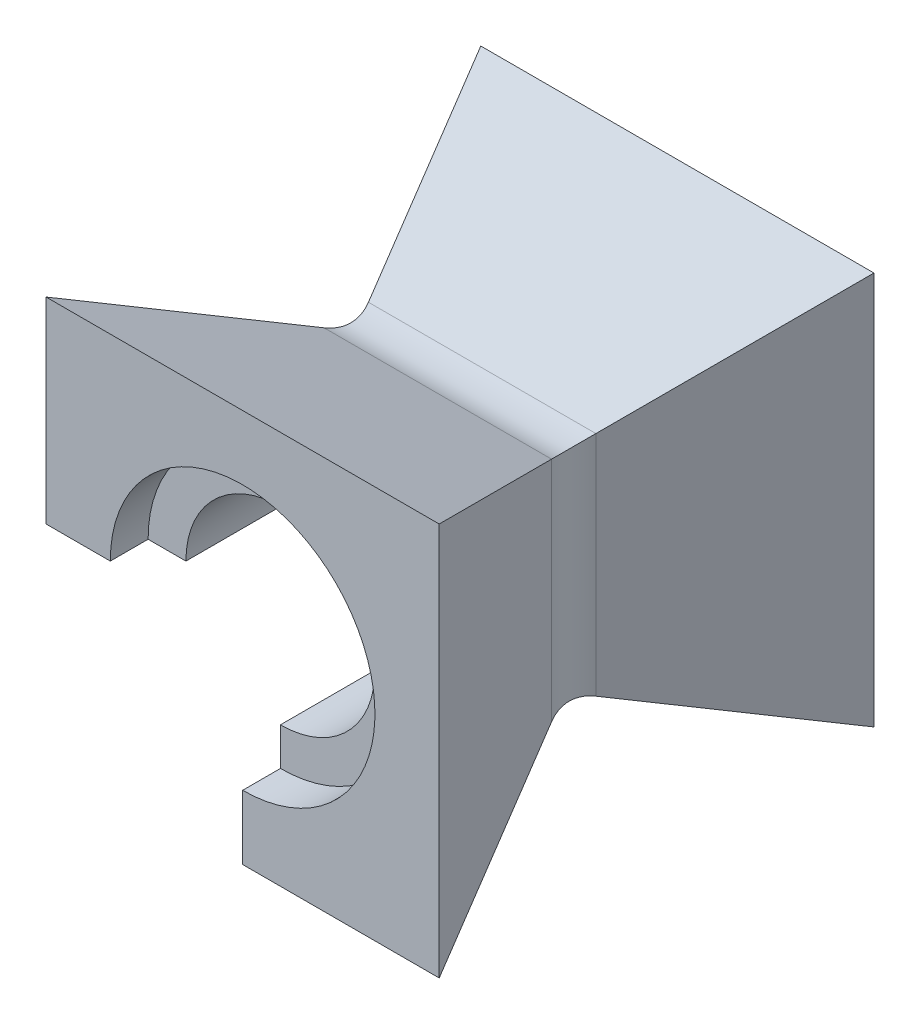
from build123d import *

# Parameters (mm, degrees)
SKETCH4_W               = 104
SKETCH4_H               = 104
BOSS_EXTRUDE2_DEPTH     = 57.5
BOSS_EXTRUDE2_TAPER     = 23
SKETCH6_R               = 25
CUT_EXTRUDE1_DEPTH      = 179.5
CUT_EXTRUDE_THIN1_START = 10
CUT_EXTRUDE_THIN1_DEPTH = 10
CUT_EXTRUDE3_DEPTH      = 124
SKETCH10_R              = 35
CUT_EXTRUDE4_DEPTH      = 10
FILLET9_R               = 15
FILLET10_R              = 15


with BuildPart() as part:
    # Sketch4 → Boss-Extrude2 (new body)
    with BuildSketch(Plane.XY):
        with Locations((52, 52)):
            Rectangle(SKETCH4_W, SKETCH4_H)
    boss_extrude2 = extrude(amount=BOSS_EXTRUDE2_DEPTH, taper=BOSS_EXTRUDE2_TAPER)

    # Mirror2: Boss-Extrude2 across plane
    add(boss_extrude2.mirror(Plane(origin=(0, 0, 57.5), x_dir=(1, 0, 0), z_dir=(0, 0, -1))))

    # Sketch6 → Cut-Extrude1 (cut)
    with BuildSketch(Plane.XY.offset(115)):
        with Locations((52, 52)):
            Circle(SKETCH6_R)
    extrude(amount=-CUT_EXTRUDE1_DEPTH, mode=Mode.SUBTRACT)

    # Sketch8 → Cut-Extrude-Thin1 (cut)
    with BuildSketch(Plane.XY.offset(CUT_EXTRUDE_THIN1_START)):
        with BuildLine():
            ThreePointArc((52, 17), (76.748737342, 76.748737342), (17, 52))
            Line((17, 52), (7, 52))
            ThreePointArc((7, 52), (83.819805153, 83.819805153), (52, 7))
            Line((52, 7), (52, 17))
        make_face()
        with BuildLine():
            ThreePointArc((52, 27), (69.67766953, 69.67766953), (27, 52))
            Line((27, 52), (17, 52))
            ThreePointArc((17, 52), (76.748737342, 76.748737342), (52, 17))
            Line((52, 17), (52, 27))
        make_face()
    extrude(amount=-CUT_EXTRUDE_THIN1_DEPTH, mode=Mode.SUBTRACT)

    # Sketch9 → Cut-Extrude3 (cut)
    with BuildSketch(Plane(origin=(0, 0, 0), x_dir=(-1, 0, 0), z_dir=(0, 0, -1))):
        Polygon((-27, 52), (0, 52), (0, 0), (-52, 0), (-52, 27), (-52, 52), align=None)
    extrude(amount=-CUT_EXTRUDE3_DEPTH, mode=Mode.SUBTRACT)

    # Sketch10 → Cut-Extrude4 (cut)
    with BuildSketch(Plane.XY.offset(115)):
        with Locations((52, 52)):
            Circle(SKETCH10_R)
    extrude(amount=-CUT_EXTRUDE4_DEPTH, mode=Mode.SUBTRACT)

    # Fillet9
    fillet9_edges = [part.edges().sort_by_distance(p)[0] for p in [
        (65.796349034, 24.407301932, 57.5),
    ]]
    fillet(fillet9_edges, radius=FILLET9_R)

    # Fillet10
    fillet10_edges = [part.edges().sort_by_distance(p)[0] for p in [
        (24.407301932, 65.796349034, 57.5),
        (52, 79.592698068, 57.5),
        (79.592698068, 51.352297169, 57.5),
    ]]
    fillet(fillet10_edges, radius=FILLET10_R)


solid = part.part
